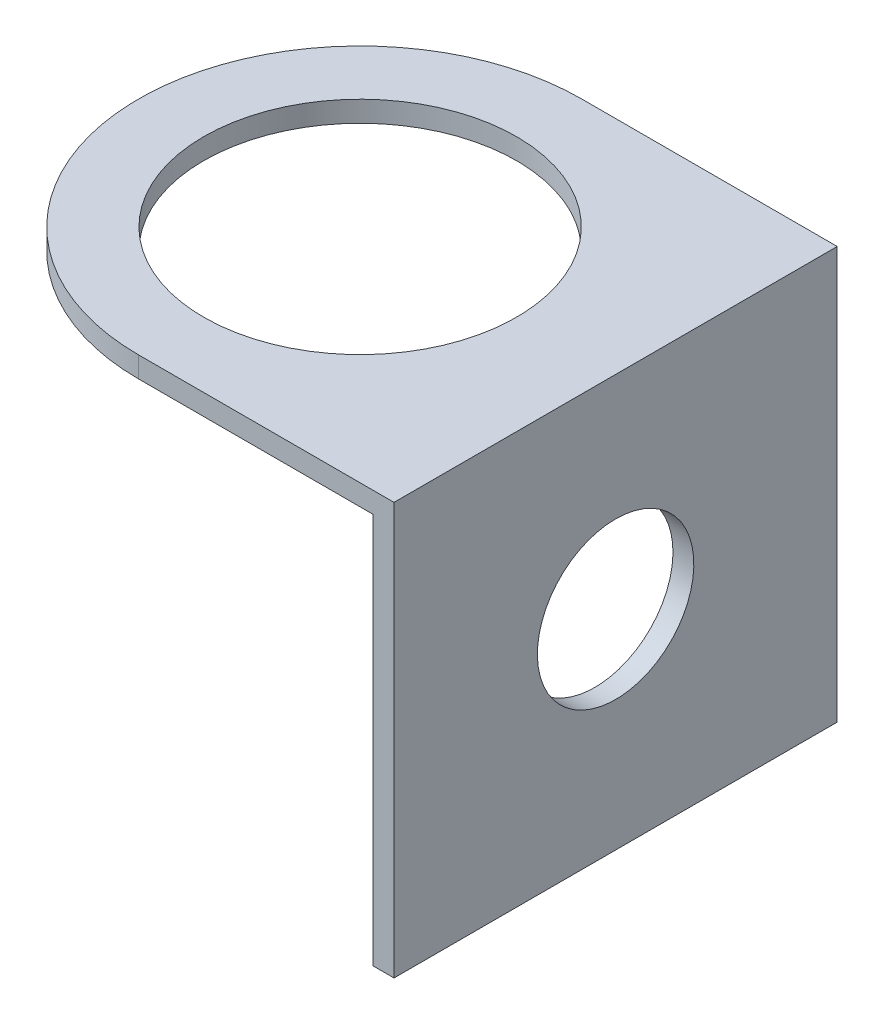
from build123d import *

# Parameters (mm, degrees)
EXTRUDE_1_DEPTH     = 170
SKETCH_2_R          = 60
CUT_EXTRUDE_1_DEPTH = 180
SKETCH_3_R          = 30
CUT_EXTRUDE_2_DEPTH = 180


with BuildPart() as part:
    # 草图1 → 凸台-拉伸1 (new body)
    with BuildSketch(Plane.XY):
        Polygon((-180, 0), (0, 0), (0, -150), (8, -150), (8, 8), (-180, 8), align=None)
    extrude(amount=EXTRUDE_1_DEPTH)

    # 草图2 → 切除-拉伸1 (cut)
    with BuildSketch(Plane(origin=(0, 8, 0), x_dir=(1, 0, 0), z_dir=(0, 1, 0))):
        with Locations(Location((-90, -85, 0), (0, 0, 180))):
            Circle(SKETCH_2_R)
        with BuildLine():
            ThreePointArc((-90, -170), (-175, -85), (-90, 0))
            Line((-90, 0), (-180, 0))
            Line((-180, 0), (-180, -170))
            Line((-180, -170), (-90, -170))
        make_face()
    extrude(amount=-CUT_EXTRUDE_1_DEPTH, mode=Mode.SUBTRACT)

    # 草图3 → 切除-拉伸2 (cut)
    with BuildSketch(Plane(origin=(8, 0, 0), x_dir=(0, 0, -1), z_dir=(1, 0, 0))):
        with Locations(Location((-85, -70, 0), (0, 0, 90))):
            Circle(SKETCH_3_R)
    extrude(amount=-CUT_EXTRUDE_2_DEPTH, mode=Mode.SUBTRACT)


solid = part.part
